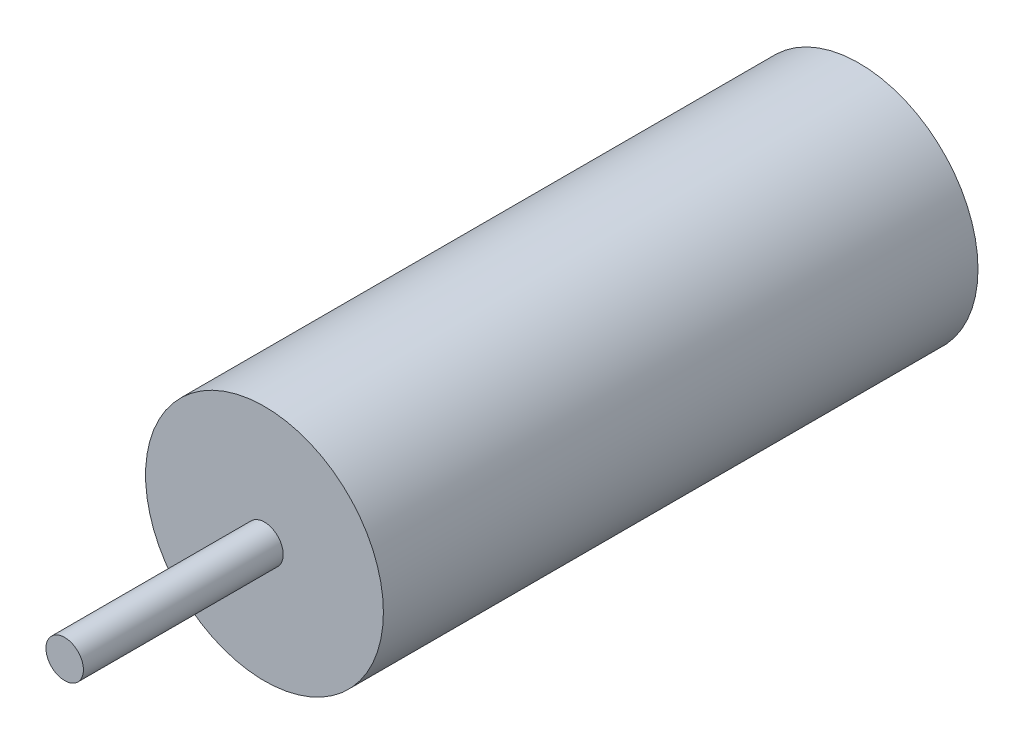
from build123d import *

# Parameters (mm, degrees)
SKETCH1_R           = 25.4
BOSS_EXTRUDE1_DEPTH = 127
SKETCH2_R           = 4.0005
BOSS_EXTRUDE2_DEPTH = 42.672


with BuildPart() as part:
    # Sketch1 → Boss-Extrude1 (new body)
    with BuildSketch(Plane.XY):
        Circle(SKETCH1_R)
    extrude(amount=BOSS_EXTRUDE1_DEPTH)

    # Sketch2 → Boss-Extrude2 (add)
    with BuildSketch(Plane.XY.offset(127)):
        Circle(SKETCH2_R)
    extrude(amount=BOSS_EXTRUDE2_DEPTH)


solid = part.part
